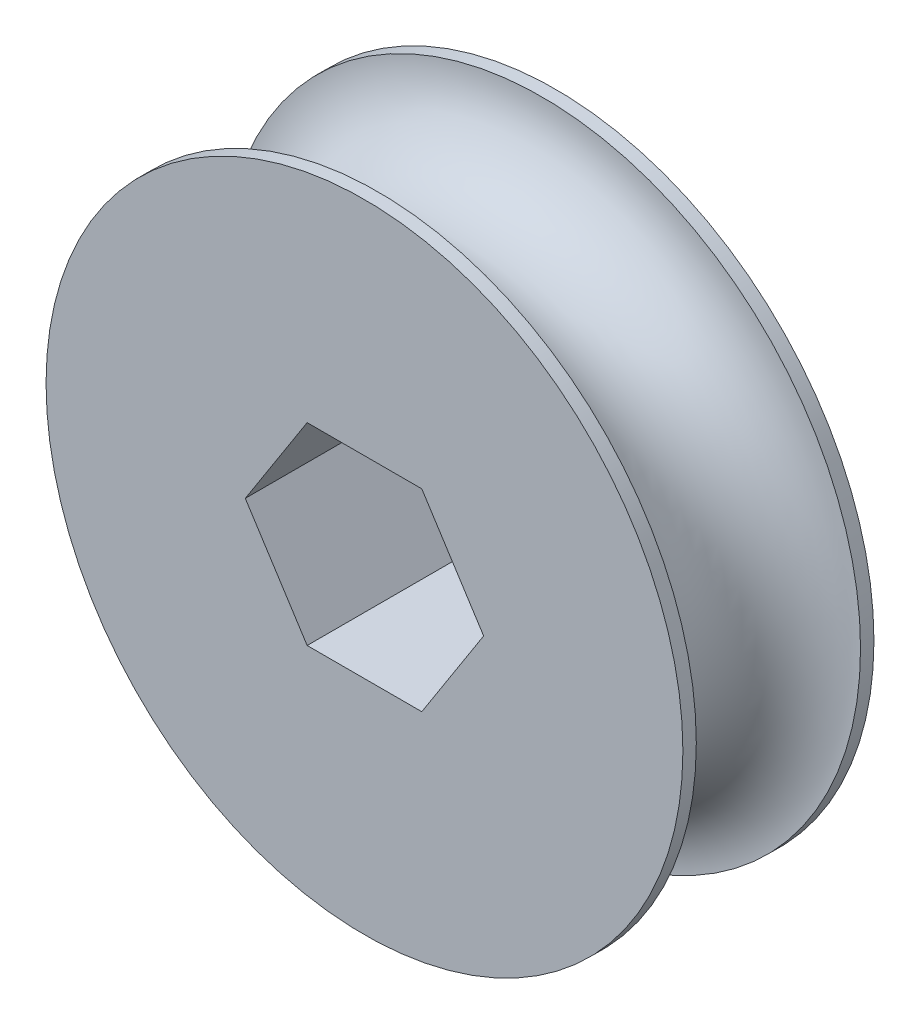
from build123d import *

# Parameters (mm, degrees)
SKETCH1_R           = 50
BOSS_EXTRUDE1_DEPTH = 30
SKETCH2_R           = 12.893523165


with BuildPart() as part:
    # Sketch1 → Boss-Extrude1 (new body)
    with BuildSketch(Plane.XY):
        Circle(SKETCH1_R)
        Polygon((-9, 15.15359655), (9, 15.15359655), (18.714345659, 0), (9, -15.15359655), (-9, -15.15359655), (-18.714345659, 0), align=None, mode=Mode.SUBTRACT)
    extrude(amount=BOSS_EXTRUDE1_DEPTH)

    # Sketch2 → Cut-Revolve1 (revolve, cut)
    with BuildSketch(Plane(origin=(0, 0, 0), x_dir=(0, 0, -1), z_dir=(1, 0, 0)), mode=Mode.PRIVATE) as cut_revolve1_sk:
        with Locations((-15, 50)):
            Circle(SKETCH2_R)
    revolve(cut_revolve1_sk.sketch.rotate(Axis((0, 0, -15.913585238), (0, 0, 1)), 90), axis=Axis((0, 0, -15.913585238), (0, 0, 1)), mode=Mode.SUBTRACT)


solid = part.part
